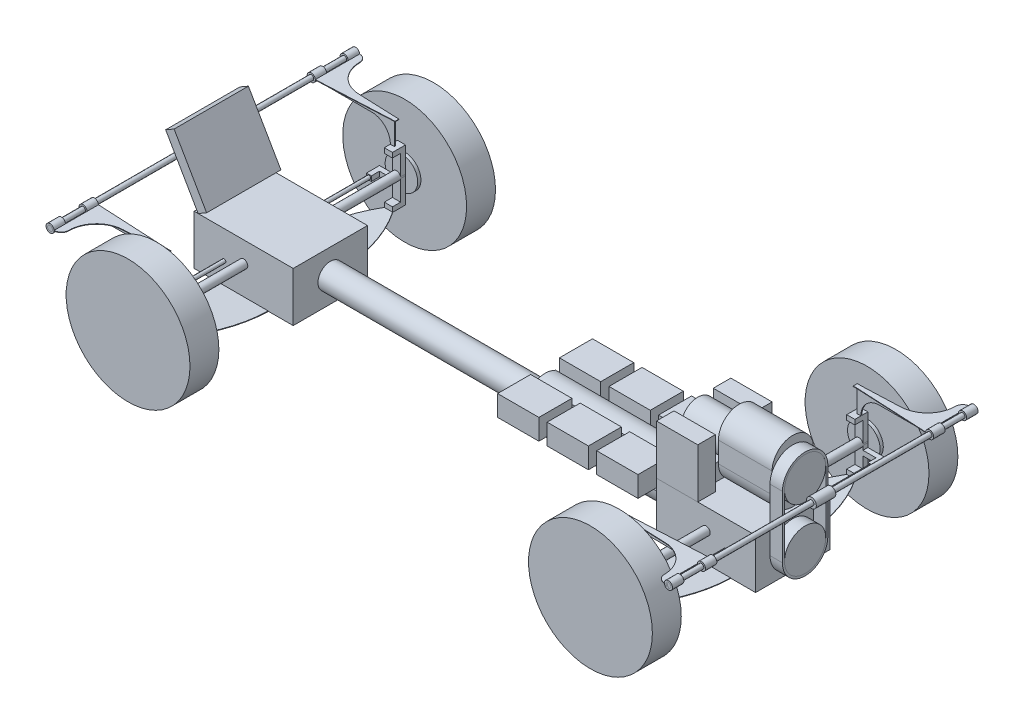
from build123d import *

# Parameters (mm, degrees)
SKETCH4_R              = 381
BOSS_EXTRUDE1_DEPTH    = 88.9
BOSS_EXTRUDE1_2_DEPTH  = 88.9
SKETCH3_R              = 381
BOSS_EXTRUDE2_DEPTH    = 88.9
BOSS_EXTRUDE2_2_DEPTH  = 88.9
BOSS_EXTRUDE3_START    = 203.2
SKETCH1_W              = 609.6
SKETCH1_H              = 457.2
BOSS_EXTRUDE3_DEPTH    = 304.8
BOSS_EXTRUDE3_2_DEPTH  = 304.8
SKETCH5_R              = 76.2
BOSS_EXTRUDE4_DEPTH    = 914.4
SKETCH5_3_R            = 76.2
BOSS_EXTRUDE5_DEPTH    = 2235.2
SKETCH6_R              = 127
BOSS_EXTRUDE6_DEPTH    = 76.2
BOSS_EXTRUDE6_2_DEPTH  = 76.2
BOSS_EXTRUDE8_DEPTH    = 330.2
SKETCH9_R              = 101.6
BOSS_EXTRUDE9_DEPTH    = 254
BOSS_EXTRUDE10_DEPTH   = 76.2
SKETCH11_W             = 254
SKETCH11_H             = 203.2
BOSS_EXTRUDE11_DEPTH   = 127
BOSS_EXTRUDE11_2_DEPTH = 127
BOSS_EXTRUDE11_3_DEPTH = 127
BOSS_EXTRUDE11_4_DEPTH = 127
BOSS_EXTRUDE11_5_DEPTH = 127
BOSS_EXTRUDE11_6_DEPTH = 127
BOSS_EXTRUDE12_DEPTH   = 304.8
BOSS_EXTRUDE12_2_DEPTH = 304.8
SKETCH12_3_W           = 177.8
SKETCH12_3_H           = 120.65
BOSS_EXTRUDE13_DEPTH   = 101.6
BOSS_EXTRUDE15_REACH   = 2649.242
SKETCH13_R             = 25.4
BOSS_EXTRUDE16_DEPTH   = 457.2
SKETCH16_R             = 100
BOSS_EXTRUDE17_DEPTH   = 20
BOSS_EXTRUDE18_START   = 20
SKETCH16_3_W           = 50
SKETCH16_3_H           = 30
SKETCH16_3_W_2         = 30
BOSS_EXTRUDE18_DEPTH   = 30
BOSS_EXTRUDE19_START   = 50
SKETCH16_4_W           = 30
SKETCH16_4_H           = 30
SKETCH16_4_W_2         = 50
BOSS_EXTRUDE19_DEPTH   = 50
SWEEP1_PROFILE_R       = 15
SWEEP2_PROFILE_R       = 30
SWEEP3_PROFILE_R       = 25
SWEEP4_PROFILE_R       = 25
BOSS_EXTRUDE20_DEPTH   = 1.5
BOSS_EXTRUDE21_DEPTH   = 144
CUT_EXTRUDE1_REACH     = 2699.884
BOSS_EXTRUDE22_DEPTH   = 1.5
SKETCH101_R            = 11
BOSS_EXTRUDE23_DEPTH   = 433.4


with BuildPart() as part:
    # Sketch4 → Boss-Extrude1 (new, symmetric)
    with BuildSketch(Plane.XY.offset(-850.9)):
        with Locations((1422.4, 381)):
            Circle(SKETCH4_R)
    extrude(amount=BOSS_EXTRUDE1_DEPTH, both=True)


with BuildPart() as body_2:
    # Sketch4 → Boss-Extrude1 2 (new, symmetric)
    with BuildSketch(Plane.XY.offset(-850.9)):
        with Locations((-1422.4, 381)):
            Circle(SKETCH4_R)
    extrude(amount=BOSS_EXTRUDE1_2_DEPTH, both=True)


with BuildPart() as body_3:
    # Sketch3 → Boss-Extrude2 (new, symmetric)
    with BuildSketch(Plane.XY.offset(850.9)):
        with Locations((1422.4, 381)):
            Circle(SKETCH3_R)
    extrude(amount=BOSS_EXTRUDE2_DEPTH, both=True)


with BuildPart() as body_4:
    # Sketch3 → Boss-Extrude2 2 (new, symmetric)
    with BuildSketch(Plane.XY.offset(850.9)):
        with Locations((-1422.4, 381)):
            Circle(SKETCH3_R)
    extrude(amount=BOSS_EXTRUDE2_2_DEPTH, both=True)

    # Boss-Extrude15: up to this face of the body (flat: up to its plane)
    boss_extrude15_end = Plane(body_4.part.faces().sort_by_distance((-1422.4, 381, 762))[0])
    # Sketch13 → Boss-Extrude15 (add, up to the picked face)
    with BuildSketch(Plane.XY.offset(-762), mode=Mode.PRIVATE) as boss_extrude15_sk1:
        with Locations(Location((-1422.4, 381, 0), (0, 0, 180))):
            Circle(SKETCH13_R)
    boss_extrude15_tool1 = split(extrude(boss_extrude15_sk1.sketch, amount=BOSS_EXTRUDE15_REACH, mode=Mode.PRIVATE), bisect_by=boss_extrude15_end, keep=Keep.BOTH, mode=Mode.PRIVATE)
    # Sketch13 → Boss-Extrude15 (add, up to the picked face)
    with BuildSketch(Plane.XY.offset(-762), mode=Mode.PRIVATE) as boss_extrude15_sk2:
        with Locations(Location((1422.4, 381, 0), (0, 0, 180))):
            Circle(SKETCH13_R)
    boss_extrude15_tool2 = split(extrude(boss_extrude15_sk2.sketch, amount=BOSS_EXTRUDE15_REACH, mode=Mode.PRIVATE), bisect_by=boss_extrude15_end, keep=Keep.BOTH, mode=Mode.PRIVATE)

    add(part.part)  # Boss-Extrude15 merges part

    add(body_2.part)  # Boss-Extrude15 merges body 2

    add(body_3.part)  # Boss-Extrude15 merges body 3


with BuildPart() as body_5:
    # Sketch1 → Boss-Extrude3 (new body)
    with BuildSketch(Plane(origin=(0, 0, 0), x_dir=(1, 0, 0), z_dir=(0, 1, 0)).offset(BOSS_EXTRUDE3_START)):
        with Locations((1422.4, 0)):
            Rectangle(SKETCH1_W, SKETCH1_H)
    extrude(amount=BOSS_EXTRUDE3_DEPTH)


with BuildPart() as body_6:
    # Sketch1 → Boss-Extrude3 2 (new body)
    with BuildSketch(Plane(origin=(0, 0, 0), x_dir=(1, 0, 0), z_dir=(0, 1, 0)).offset(BOSS_EXTRUDE3_START)):
        with Locations((-1422.4, 0)):
            Rectangle(SKETCH1_W, SKETCH1_H)
    extrude(amount=BOSS_EXTRUDE3_2_DEPTH)


with BuildPart() as body_7:
    # Sketch5 → Boss-Extrude4 (new body)
    with BuildSketch(Plane.ZY.offset(-1117.6)):
        with BuildLine():
            Line((-65.991135768, 478.731068378), (-65.991135768, 393.7))
            ThreePointArc((-65.991135768, 393.7), (0, 431.8), (65.991135768, 393.7))
            Line((65.991135768, 393.7), (65.991135768, 478.731068378))
            ThreePointArc((65.991135768, 478.731068378), (0, 495.3), (-65.991135768, 478.731068378))
        make_face()
        with BuildLine():
            Line((139.630201095, 351.184465811), (65.991135768, 393.7))
            ThreePointArc((65.991135768, 393.7), (73.603547963, 375.322011237), (76.2, 355.6))
            ThreePointArc((76.2, 355.6), (53.881536726, 301.718463274), (0, 279.4))
            Line((0, 279.4), (73.639065327, 236.884465811))
            ThreePointArc((73.639065327, 236.884465811), (120.983748909, 285.75), (139.630201095, 351.184465811))
        make_face()
        with BuildLine():
            ThreePointArc((0, 279.4), (-65.991135768, 317.5), (-65.991135768, 393.7))
            Line((-65.991135768, 393.7), (-139.630201095, 351.184465811))
            ThreePointArc((-139.630201095, 351.184465811), (-120.983748909, 285.75), (-73.639065327, 236.884465811))
            Line((-73.639065327, 236.884465811), (0, 279.4))
        make_face()
        with Locations((0, 355.6)):
            Circle(SKETCH5_R)
    extrude(amount=BOSS_EXTRUDE4_DEPTH)


with BuildPart() as body_8:
    # Sketch5<3> → Boss-Extrude5 (new body)
    with BuildSketch(Plane.ZY.offset(-1117.6)):
        with Locations((0, 355.6)):
            Circle(SKETCH5_3_R)
    extrude(amount=BOSS_EXTRUDE5_DEPTH)


with BuildPart() as body_9:
    # Sketch6 → Boss-Extrude6 (new body)
    with BuildSketch(Plane(origin=(1727.2, 0, 0), x_dir=(0, 0, -1), z_dir=(1, 0, 0))):
        with Locations(Location((0, 355.6, 0), (0, 0, 180))):
            Circle(SKETCH6_R)
    extrude(amount=BOSS_EXTRUDE6_DEPTH)


with BuildPart() as body_10:
    # Sketch6 → Boss-Extrude6 2 (new body)
    with BuildSketch(Plane(origin=(1727.2, 0, 0), x_dir=(0, 0, -1), z_dir=(1, 0, 0))):
        with Locations(Location((0, 736.6, 0), (0, 0, 180))):
            Circle(SKETCH6_R)
    extrude(amount=BOSS_EXTRUDE6_2_DEPTH)


with BuildPart() as body_11:
    # Sketch8 → Boss-Extrude8 (new body)
    with BuildSketch(Plane.ZY.offset(-1727.2)):
        with BuildLine():
            Line((-127, 673.1), (-127, 800.1))
            ThreePointArc((-127, 800.1), (0, 927.1), (127, 800.1))
            Line((127, 800.1), (127, 673.1))
            ThreePointArc((127, 673.1), (0, 546.1), (-127, 673.1))
        make_face()
    extrude(amount=BOSS_EXTRUDE8_DEPTH)


with BuildPart() as body_12:
    # Sketch9 → Boss-Extrude9 (new body)
    with BuildSketch(Plane.ZY.offset(-1397)):
        with Locations((0, 736.6)):
            Circle(SKETCH9_R)
    extrude(amount=BOSS_EXTRUDE9_DEPTH)


with BuildPart() as body_13:
    # Sketch6<3> → Boss-Extrude10 (new body)
    with BuildSketch(Plane(origin=(1727.2, 0, 0), x_dir=(0, 0, -1), z_dir=(1, 0, 0))):
        with BuildLine():
            Line((139.7, 736.6), (139.7, 355.6))
            ThreePointArc((139.7, 355.6), (0, 215.9), (-139.7, 355.6))
            Line((-139.7, 355.6), (-139.7, 736.6))
            ThreePointArc((-139.7, 736.6), (0, 876.3), (139.7, 736.6))
        make_face()
        with BuildLine():
            Line((-127, 355.6), (-127, 736.6))
            ThreePointArc((-127, 736.6), (0, 863.6), (127, 736.6))
            Line((127, 736.6), (127, 355.6))
            ThreePointArc((127, 355.6), (0, 228.6), (-127, 355.6))
        make_face(mode=Mode.SUBTRACT)
    extrude(amount=BOSS_EXTRUDE10_DEPTH)


with BuildPart() as body_14:
    # Sketch11 → Boss-Extrude11 (new body)
    with BuildSketch(Plane(origin=(0, 406.4, 0), x_dir=(1, 0, 0), z_dir=(0, 1, 0))):
        with Locations((635, -190.260072631)):
            Rectangle(SKETCH11_W, SKETCH11_H)
    extrude(amount=BOSS_EXTRUDE11_DEPTH)


with BuildPart() as body_15:
    # Sketch11 → Boss-Extrude11 2 (new body)
    with BuildSketch(Plane(origin=(0, 406.4, 0), x_dir=(1, 0, 0), z_dir=(0, 1, 0))):
        with Locations((330.2, -190.260072631)):
            Rectangle(SKETCH11_W, SKETCH11_H)
    extrude(amount=BOSS_EXTRUDE11_2_DEPTH)


with BuildPart() as body_16:
    # Sketch11 → Boss-Extrude11 3 (new body)
    with BuildSketch(Plane(origin=(0, 406.4, 0), x_dir=(1, 0, 0), z_dir=(0, 1, 0))):
        with Locations((939.8, -190.260072631)):
            Rectangle(SKETCH11_W, SKETCH11_H)
    extrude(amount=BOSS_EXTRUDE11_3_DEPTH)


with BuildPart() as body_17:
    # Sketch11 → Boss-Extrude11 4 (new body)
    with BuildSketch(Plane(origin=(0, 406.4, 0), x_dir=(1, 0, 0), z_dir=(0, 1, 0))):
        with Locations((939.8, 190.260072631)):
            Rectangle(SKETCH11_W, SKETCH11_H)
    extrude(amount=BOSS_EXTRUDE11_4_DEPTH)


with BuildPart() as body_18:
    # Sketch11 → Boss-Extrude11 5 (new body)
    with BuildSketch(Plane(origin=(0, 406.4, 0), x_dir=(1, 0, 0), z_dir=(0, 1, 0))):
        with Locations((635, 190.260072631)):
            Rectangle(SKETCH11_W, SKETCH11_H)
    extrude(amount=BOSS_EXTRUDE11_5_DEPTH)


with BuildPart() as body_19:
    # Sketch11 → Boss-Extrude11 6 (new body)
    with BuildSketch(Plane(origin=(0, 406.4, 0), x_dir=(1, 0, 0), z_dir=(0, 1, 0))):
        with Locations((330.2, 190.260072631)):
            Rectangle(SKETCH11_W, SKETCH11_H)
    extrude(amount=BOSS_EXTRUDE11_6_DEPTH)


with BuildPart() as body_20:
    # Sketch12 → Boss-Extrude12 (new body)
    with BuildSketch(Plane(origin=(0, 508, 0), x_dir=(1, 0, 0), z_dir=(0, 1, 0))):
        Polygon((1371.6, 228.6), (1117.6, 228.6), (1117.6, 120.65), (1143, 120.65), (1320.8, 120.65), (1371.6, 120.65), align=None)
    extrude(amount=BOSS_EXTRUDE12_DEPTH)



with BuildPart() as body_21:
    # Sketch12 → Boss-Extrude12 2 (new body)
    with BuildSketch(Plane(origin=(0, 508, 0), x_dir=(1, 0, 0), z_dir=(0, 1, 0))):
        Polygon((1143, -120.65), (1117.6, -120.65), (1117.6, -228.6), (1371.6, -228.6), (1371.6, -120.65), (1320.8, -120.65), align=None)
    extrude(amount=BOSS_EXTRUDE12_2_DEPTH)


with BuildPart() as body_20_1:
    add(body_20.part)

    add(body_21.part)  # Boss-Extrude13 merges body 21
    # Sketch12<3> → Boss-Extrude13 (add)
    with BuildSketch(Plane(origin=(0, 508, 0), x_dir=(1, 0, 0), z_dir=(0, 1, 0))):
        with Locations((1231.9, -60.325)):
            Rectangle(SKETCH12_3_W, SKETCH12_3_H)
        with Locations((1231.9, 60.325)):
            Rectangle(SKETCH12_3_W, SKETCH12_3_H)
    extrude(amount=BOSS_EXTRUDE13_DEPTH)


with BuildPart() as body_4_1:
    add(body_4.part)

    add(body_5.part)  # Boss-Extrude15 merges body 5

    add(body_6.part)  # Boss-Extrude15 merges body 6
    add(boss_extrude15_tool1.solids().sort_by(Axis((-1422.4, 381, -762), (0, 0, 1)))[0])
    add(boss_extrude15_tool2.solids().sort_by(Axis((1422.4, 381, -762), (0, 0, 1)))[0])


with BuildPart() as body_16_2:
    # Sketch15 → Boss-Extrude16 (new body)
    with BuildSketch(Plane.XY.offset(228.6)):
        Polygon((-1902.2, 854.410161514), (-1702.2, 508), (-1650.238475773, 538), (-1850.238475773, 884.410161514), align=None)
    extrude(amount=-BOSS_EXTRUDE16_DEPTH)


with BuildPart() as body_17_2:
    # Sketch16 → Boss-Extrude17 (new body)
    with BuildSketch(Plane(origin=(0, 0, 762), x_dir=(-1, 0, 0), z_dir=(0, 0, -1))):
        with Locations((1422.4, 381)):
            Circle(SKETCH16_R)
    extrude(amount=BOSS_EXTRUDE17_DEPTH)

    # Sketch16<3> → Boss-Extrude18 (add)
    with BuildSketch(Plane(origin=(0, 0, 762), x_dir=(-1, 0, 0), z_dir=(0, 0, -1)).offset(BOSS_EXTRUDE18_START)):
        with Locations((1422.4, 526)):
            Rectangle(SKETCH16_3_W, SKETCH16_3_H)
        with BuildLine():
            Line((1397.4, 511), (1397.4, 477.824583655))
            ThreePointArc((1397.4, 477.824583655), (1422.4, 481), (1447.4, 477.824583655))
            Line((1447.4, 477.824583655), (1447.4, 511))
            Line((1447.4, 511), (1397.4, 511))
        make_face()
        with BuildLine():
            Line((1397.4, 376.510011136), (1397.4, 284.175416345))
            ThreePointArc((1397.4, 284.175416345), (1422.4, 281), (1447.4, 284.175416345))
            Line((1447.4, 284.175416345), (1447.4, 321))
            Line((1447.4, 321), (1447.4, 351))
            Line((1447.4, 351), (1447.4, 376.510011136))
            ThreePointArc((1447.4, 376.510011136), (1422.4, 355.6), (1397.4, 376.510011136))
        make_face()
        with BuildLine():
            ThreePointArc((1447.4, 477.824583655), (1422.4, 481), (1397.4, 477.824583655))
            Line((1397.4, 477.824583655), (1397.4, 385.489988864))
            ThreePointArc((1397.4, 385.489988864), (1422.4, 406.4), (1447.4, 385.489988864))
            Line((1447.4, 385.489988864), (1447.4, 477.824583655))
        make_face()
        with BuildLine():
            Line((1397.4, 284.175416345), (1397.4, 251))
            Line((1397.4, 251), (1447.4, 251))
            Line((1447.4, 251), (1447.4, 284.175416345))
            ThreePointArc((1447.4, 284.175416345), (1422.4, 281), (1397.4, 284.175416345))
        make_face()
        with Locations((1422.4, 236)):
            Rectangle(SKETCH16_3_W, SKETCH16_3_H)
        with BuildLine():
            Line((1447.4, 351), (1447.4, 321))
            Line((1447.4, 321), (1502.4, 321))
            ThreePointArc((1502.4, 321), (1511.370538976, 335.346487601), (1517.793920142, 351))
            Line((1517.793920142, 351), (1447.4, 351))
        make_face()
        with Locations((1542.4, 336)):
            Rectangle(SKETCH16_3_W_2, SKETCH16_3_H)
        with BuildLine():
            ThreePointArc((1517.793920142, 351), (1511.370538976, 335.346487601), (1502.4, 321))
            Line((1502.4, 321), (1527.4, 321))
            Line((1527.4, 321), (1527.4, 351))
            Line((1527.4, 351), (1517.793920142, 351))
        make_face()
    extrude(amount=BOSS_EXTRUDE18_DEPTH)

    # Sketch16<4> → Boss-Extrude19 (add)
    with BuildSketch(Plane(origin=(0, 0, 762), x_dir=(-1, 0, 0), z_dir=(0, 0, -1)).offset(BOSS_EXTRUDE19_START)):
        with Locations((1542.4, 336)):
            Rectangle(SKETCH16_4_W, SKETCH16_4_H)
        with Locations((1422.4, 526)):
            Rectangle(SKETCH16_4_W_2, SKETCH16_4_H)
        with Locations((1422.4, 236)):
            Rectangle(SKETCH16_4_W_2, SKETCH16_4_H)
    extrude(amount=BOSS_EXTRUDE19_DEPTH)


with BuildPart() as body_18_2:
    # Sweep1: sweep along a path in Sketch17
    with BuildLine(Plane.ZY.offset(1902.2)) as sweep1_path:
        Line((-939.8, 685), (939.8, 685))
    # Sweep1 profile (on start of the path) → Sweep1 (sweep)
    with BuildSketch(Plane(origin=(-1902.2, 685, -939.8), x_dir=(1, 0, 0), z_dir=(0, 0, 1))):
        Circle(SWEEP1_PROFILE_R)
    sweep(path=sweep1_path.line)

    # Sweep2: sweep along a path in Sketch17<3>
    with BuildLine(Plane.ZY.offset(1902.2)) as sweep2_path:
        Line((-60, 685), (60, 685))
    # Sweep2 profile (on start of the path) → Sweep2 (sweep)
    with BuildSketch(Plane(origin=(-1902.2, 685, -60), x_dir=(1, 0, 0), z_dir=(0, 0, 1))):
        Circle(SWEEP2_PROFILE_R)
    sweep(path=sweep2_path.line)


with BuildPart() as body_19_2:
    # Sweep3: sweep along a path in Sketch17<4>
    with BuildLine(Plane.ZY.offset(1902.2)) as sweep3_path:
        Line((939.8, 685), (869.8, 685))
    # Sweep3 profile (on start of the path) → Sweep3 (sweep)
    with BuildSketch(Plane(origin=(-1902.2, 685, 939.8), x_dir=(-1, 0, 0), z_dir=(0, 0, -1))):
        Circle(SWEEP3_PROFILE_R)
    sweep(path=sweep3_path.line)


with BuildPart() as body_20_2:
    # Sweep4: sweep along a path in Sketch17<5>
    with BuildLine(Plane.ZY.offset(1902.2)) as sweep4_path:
        Line((667, 685), (737, 685))
    # Sweep4 profile (on start of the path) → Sweep4 (sweep)
    with BuildSketch(Plane(origin=(-1902.2, 685, 667), x_dir=(1, 0, 0), z_dir=(0, 0, 1))):
        Circle(SWEEP4_PROFILE_R)
    sweep(path=sweep4_path.line)


with BuildPart() as body_21_2:
    # Sketch98 → Boss-Extrude20 (new, symmetric)
    with BuildSketch(Plane(origin=(0, 685, 0), x_dir=(1, 0, 0), z_dir=(0, 1, 0))):
        with BuildLine():
            Line((-1877.2, -667), (-1434.9, -689.5))
            Line((-1434.9, -689.5), (-1409.9, -689.5))
            Line((-1409.9, -689.5), (-1409.9, -714.5))
            Line((-1409.9, -714.5), (-1434.9, -714.5))
            Line((-1434.9, -714.5), (-1667.786671724, -723.721419021))
            ThreePointArc((-1667.786671724, -723.721419021), (-1784.89376872, -776.352986479), (-1832.850764159, -895.450764159))
            ThreePointArc((-1832.850764159, -895.450764159), (-1845.840354597, -926.810409563), (-1877.2, -939.8))
            Line((-1877.2, -939.8), (-1877.2, -667))
        make_face()
    extrude(amount=BOSS_EXTRUDE20_DEPTH, both=True)

    # Sketch98<4> → Boss-Extrude21 (add)
    with BuildSketch(Plane(origin=(0, 685, 0), x_dir=(1, 0, 0), z_dir=(0, 1, 0))):
        Polygon((-1434.9, -699), (-1877.2, -699), (-1877.2, -709), (-1434.9, -705.109938434), align=None)
        Polygon((-1422.4, -699), (-1434.9, -699), (-1434.9, -705.109938434), (-1422.4, -705), align=None)
    extrude(amount=-BOSS_EXTRUDE21_DEPTH)

    # Cut-Extrude1: up to this plane
    cut_extrude1_end = Plane(origin=(6.09002923, 86.09007485, 692.436323402), z_dir=(-0.008794734613665011, 0, -0.999961325573682))
    # Sketch99 → Cut-Extrude1 (cut, up to the surface)
    with BuildSketch(Plane(origin=(0, 0, 699), x_dir=(-1, 0, 0), z_dir=(0, 0, -1)), mode=Mode.PRIVATE) as cut_extrude1_sk1:
        with BuildLine():
            Line((1902.2, 655), (1561.4, 655))
            ThreePointArc((1561.4, 655), (1480.789826945, 621.610173055), (1447.4, 541))
            Line((1447.4, 541), (1877.2, 541))
            Line((1877.2, 541), (1902.2, 655))
        make_face()
    cut_extrude1_tool1 = split(extrude(cut_extrude1_sk1.sketch, amount=-CUT_EXTRUDE1_REACH, mode=Mode.PRIVATE), bisect_by=cut_extrude1_end, keep=Keep.BOTH, mode=Mode.PRIVATE)
    add(cut_extrude1_tool1.solids().sort_by_distance((-1680.069906, 596.721943, 699))[0], mode=Mode.SUBTRACT)


with BuildPart() as body_22:
    # Sketch100 → Boss-Extrude22 (new, symmetric)
    with BuildSketch(Plane(origin=(0, 193.484890546, -7.946541421), x_dir=(-1, 0, 0), z_dir=(0, -0.9991576682029347, 0.04103600944626743))):
        with BuildLine():
            Line((1271.038406954, -236.745960071), (1573.761593046, -236.745960071))
            ThreePointArc((1573.761593046, -236.745960071), (1543.291979241, -463.746419229), (1447.4, -671.742414721))
            Line((1447.4, -671.742414721), (1397.4, -671.742414721))
            ThreePointArc((1397.4, -671.742414721), (1301.508020759, -463.746419229), (1271.038406954, -236.745960071))
        make_face()
    extrude(amount=BOSS_EXTRUDE22_DEPTH, both=True)


with BuildPart() as body_23:
    # Sketch101 → Boss-Extrude23 (new body)
    with BuildSketch(Plane(origin=(0, 0, 662), x_dir=(-1, 0, 0), z_dir=(0, 0, -1))):
        with Locations((1542.4, 336)):
            Circle(SKETCH101_R)
    extrude(amount=BOSS_EXTRUDE23_DEPTH)


with BuildPart() as body_24:
    # Mirror1: mirrored copy
    add(body_17_2.part.mirror(Plane.XY))


with BuildPart() as body_25:
    # Mirror1 2: mirrored copy
    add(body_19_2.part.mirror(Plane.XY))


with BuildPart() as body_26:
    # Mirror1 3: mirrored copy
    add(body_20_2.part.mirror(Plane.XY))


with BuildPart() as body_27:
    # Mirror1 4: mirrored copy
    add(body_21_2.part.mirror(Plane.XY))


with BuildPart() as body_28:
    # Mirror1 5: mirrored copy
    add(body_22.part.mirror(Plane.XY))


with BuildPart() as body_29:
    # Mirror1 6: mirrored copy
    add(body_23.part.mirror(Plane.XY))


with BuildPart() as body_30:
    # Mirror2: mirrored copy
    add(body_17_2.part.mirror(Plane(origin=(0, 0, 0), x_dir=(0, 0, 1), z_dir=(1, 0, 0))))


with BuildPart() as body_31:
    # Mirror2 2: mirrored copy
    add(body_19_2.part.mirror(Plane(origin=(0, 0, 0), x_dir=(0, 0, 1), z_dir=(1, 0, 0))))


with BuildPart() as body_32:
    # Mirror2 3: mirrored copy
    add(body_20_2.part.mirror(Plane(origin=(0, 0, 0), x_dir=(0, 0, 1), z_dir=(1, 0, 0))))


with BuildPart() as body_33:
    # Mirror2 4: mirrored copy
    add(body_21_2.part.mirror(Plane(origin=(0, 0, 0), x_dir=(0, 0, 1), z_dir=(1, 0, 0))))


with BuildPart() as body_34:
    # Mirror2 5: mirrored copy
    add(body_22.part.mirror(Plane(origin=(0, 0, 0), x_dir=(0, 0, 1), z_dir=(1, 0, 0))))


with BuildPart() as body_35:
    # Mirror2 6: mirrored copy
    add(body_23.part.mirror(Plane(origin=(0, 0, 0), x_dir=(0, 0, 1), z_dir=(1, 0, 0))))


with BuildPart() as body_36:
    # Mirror2 7: mirrored copy
    add(body_24.part.mirror(Plane(origin=(0, 0, 0), x_dir=(0, 0, 1), z_dir=(1, 0, 0))))


with BuildPart() as body_37:
    # Mirror2 8: mirrored copy
    add(body_25.part.mirror(Plane(origin=(0, 0, 0), x_dir=(0, 0, 1), z_dir=(1, 0, 0))))


with BuildPart() as body_38:
    # Mirror2 9: mirrored copy
    add(body_26.part.mirror(Plane(origin=(0, 0, 0), x_dir=(0, 0, 1), z_dir=(1, 0, 0))))


with BuildPart() as body_39:
    # Mirror2 10: mirrored copy
    add(body_27.part.mirror(Plane(origin=(0, 0, 0), x_dir=(0, 0, 1), z_dir=(1, 0, 0))))


with BuildPart() as body_40:
    # Mirror2 11: mirrored copy
    add(body_28.part.mirror(Plane(origin=(0, 0, 0), x_dir=(0, 0, 1), z_dir=(1, 0, 0))))


with BuildPart() as body_41:
    # Mirror2 12: mirrored copy
    add(body_29.part.mirror(Plane(origin=(0, 0, 0), x_dir=(0, 0, 1), z_dir=(1, 0, 0))))


with BuildPart() as body_42:
    # Mirror3: mirrored copy
    add(body_18_2.part.mirror(Plane(origin=(0, 0, 0), x_dir=(0, 0, 1), z_dir=(1, 0, 0))))


solid = Compound([body_7.part, body_8.part, body_9.part, body_10.part, body_11.part, body_12.part, body_13.part, body_14.part, body_15.part, body_16.part, body_17.part, body_18.part, body_19.part, body_20_1.part, body_4_1.part, body_16_2.part, body_17_2.part, body_18_2.part, body_19_2.part, body_20_2.part, body_21_2.part, body_22.part, body_23.part, body_24.part, body_25.part, body_26.part, body_27.part, body_28.part, body_29.part, body_30.part, body_31.part, body_32.part, body_33.part, body_34.part, body_35.part, body_36.part, body_37.part, body_38.part, body_39.part, body_40.part, body_41.part, body_42.part])
